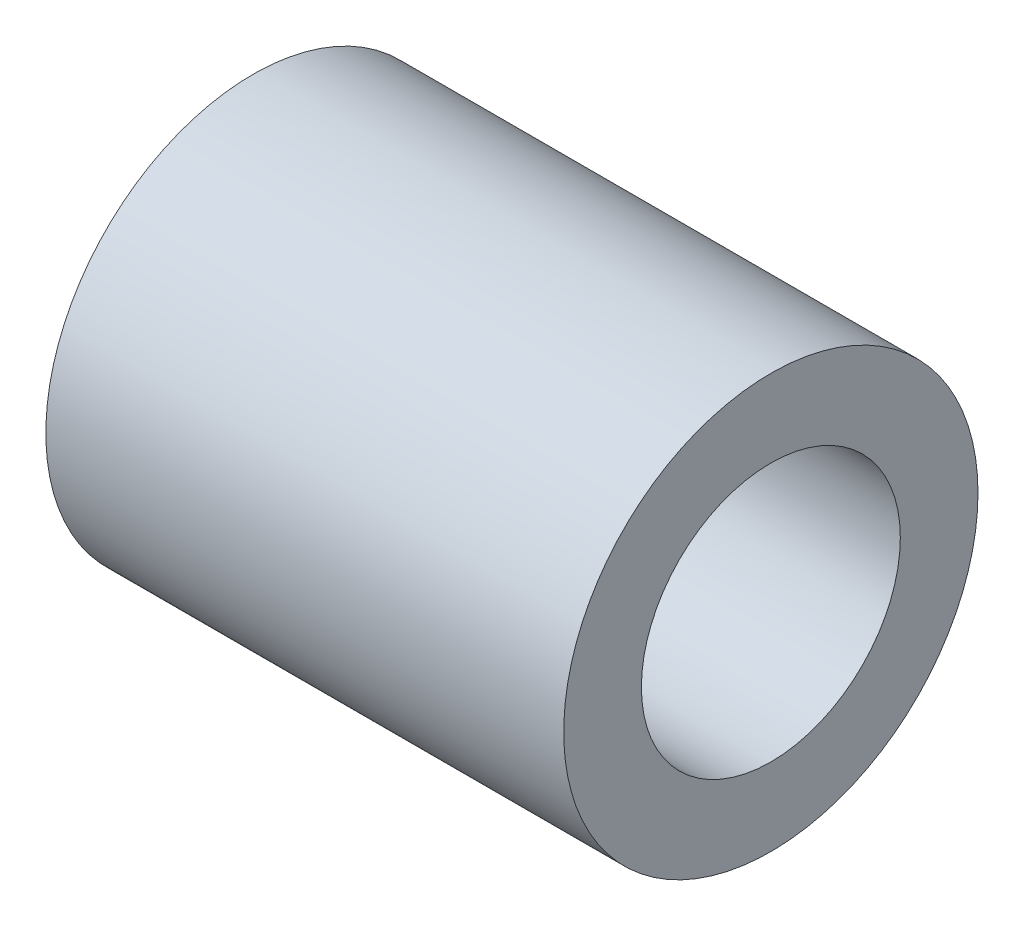
from build123d import *

# Parameters (mm, degrees)
SKETCH1_R           = 8
SKETCH1_R_2         = 5
BOSS_EXTRUDE1_DEPTH = 20


with BuildPart() as part:
    # Sketch1 → Boss-Extrude1 (new body)
    with BuildSketch(Plane(origin=(0, 0, 0), x_dir=(0, 0, -1), z_dir=(1, 0, 0))):
        Circle(SKETCH1_R)
        Circle(SKETCH1_R_2, mode=Mode.SUBTRACT)
    extrude(amount=BOSS_EXTRUDE1_DEPTH)


solid = part.part
